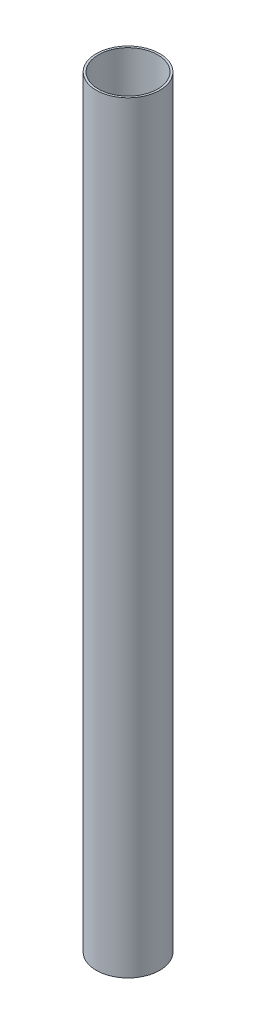
from build123d import *

# Parameters (mm, degrees)
SKETCH1_R           = 12.7
SKETCH1_R_2         = 11.8745
BOSS_EXTRUDE1_DEPTH = 152.4


with BuildPart() as part:
    # Sketch1 → Boss-Extrude1 (new, symmetric)
    with BuildSketch(Plane(origin=(0, 0, 0), x_dir=(1, 0, 0), z_dir=(0, 1, 0))):
        with Locations(Location((0, 0, 0), (0, 0, 90))):
            Circle(SKETCH1_R)
        with Locations(Location((0, 0, 0), (0, 0, 90))):
            Circle(SKETCH1_R_2, mode=Mode.SUBTRACT)
    extrude(amount=BOSS_EXTRUDE1_DEPTH, both=True)


solid = part.part
